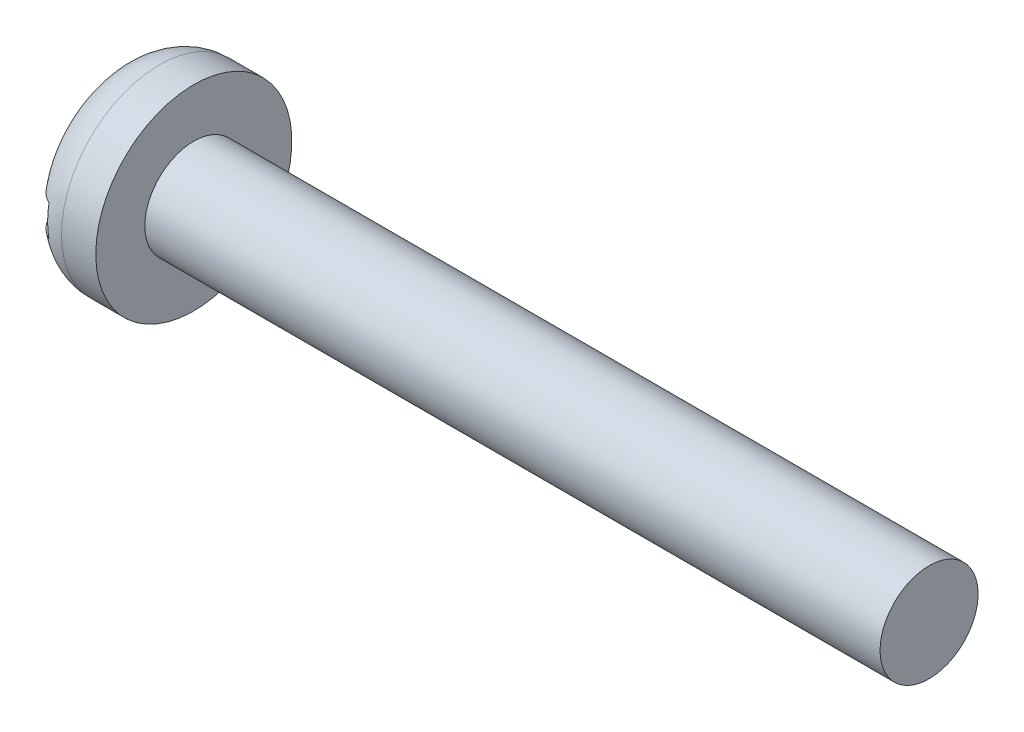
from build123d import *

# Parameters (mm, degrees)
SKETCH2_W  = 12
SKETCH2_H  = 1.9
SLOT_DEPTH = 1.4


with BuildPart() as part:
    # BodySke → Base-Revolve (revolve)
    with BuildSketch(Plane.XY, mode=Mode.PRIVATE) as base_revolve_sk:
        with BuildLine():
            Line((4.6, 3), (4.6, 6))
            Line((4.6, 6), (2.5, 6))
            ThreePointArc((2.5, 6), (0.732233047, 5.267766953), (0, 3.5))
            Line((0, 3.5), (0, 0))
            Line((0, 0), (49.6, 0))
            Line((49.6, 0), (49.6, 3))
            Line((49.6, 3), (4.6, 3))
        make_face()
    revolve(base_revolve_sk.sketch.rotate(Axis((-25.4, 0, 0), (1, 0, 0)), 90), axis=Axis((-25.4, 0, 0), (1, 0, 0)))

    # Sketch2 → Slot (cut)
    with BuildSketch(Plane(origin=(0, 0, 0), x_dir=(0, 0, -1), z_dir=(1, 0, 0))):
        Rectangle(SKETCH2_W, SKETCH2_H)
    extrude(amount=SLOT_DEPTH, mode=Mode.SUBTRACT)


solid = part.part
